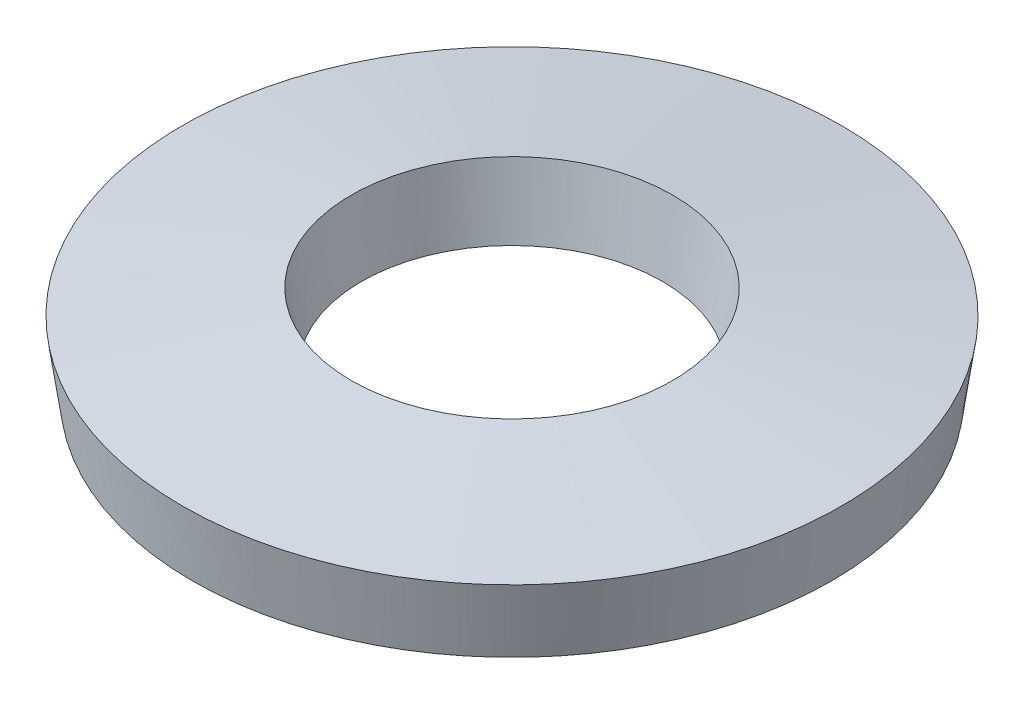
from build123d import *


with BuildPart() as part:
    # Sketch1 → Revolve1 (revolve)
    with BuildSketch(Plane.XY, mode=Mode.PRIVATE) as revolve1_sk:
        Polygon((6.786710012, 0), (3.2, 0.515241642), (3.413289988, 2), (7, 1.484758358), align=None)
    revolve(revolve1_sk.sketch.rotate(Axis((0, 0, 0), (0, 1, 0)), 90), axis=Axis((0, 0, 0), (0, 1, 0)))


solid = part.part
